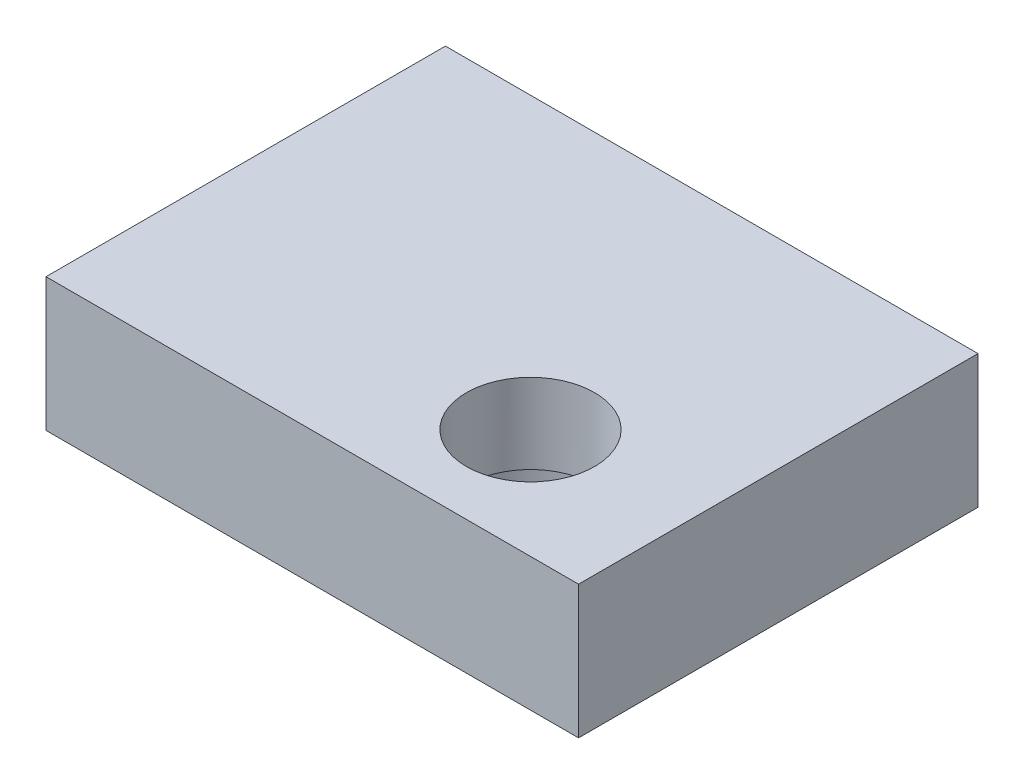
from build123d import *

# Parameters (mm, degrees)
SKETCH1_W           = 40
SKETCH1_H           = 30
BOSS_EXTRUDE1_DEPTH = 10
SKETCH2_R           = 1.55
SKETCH2_R_2         = 6.25
CUT_EXTRUDE1_DEPTH  = 4
SKETCH3_R           = 4.8125
CUT_EXTRUDE2_DEPTH  = 10


with BuildPart() as part:
    # Sketch1 → Boss-Extrude1 (new body)
    with BuildSketch(Plane(origin=(0, 0, 0), x_dir=(1, 0, 0), z_dir=(0, 1, 0))):
        Rectangle(SKETCH1_W, SKETCH1_H)
    extrude(amount=BOSS_EXTRUDE1_DEPTH)

    # Sketch2 → Cut-Extrude1 (cut)
    with BuildSketch(Plane(origin=(0, 0, 0), x_dir=(-1, 0, 0), z_dir=(0, -1, 0))):
        with Locations(Location((13.333333333, -10, 0), (0, 0, 90))):
            Circle(SKETCH2_R)
        with Locations(Location((13.333333333, 10, 0), (0, 0, 270))):
            Circle(SKETCH2_R)
        with Locations(Location((-13.333333333, 10, 0), (0, 0, 90))):
            Circle(SKETCH2_R)
        with Locations(Location((-8.14, -6.75, 0), (0, 0, 90))):
            Circle(SKETCH2_R_2)
    extrude(amount=-CUT_EXTRUDE1_DEPTH, mode=Mode.SUBTRACT)

    # Sketch3 → Cut-Extrude2 (cut)
    with BuildSketch(Plane(origin=(0, 10, 0), x_dir=(1, 0, 0), z_dir=(0, 1, 0))):
        with Locations(Location((8.14, -6.75, 0), (0, 0, 270))):
            Circle(SKETCH3_R)
    extrude(amount=-CUT_EXTRUDE2_DEPTH, mode=Mode.SUBTRACT)


solid = part.part
